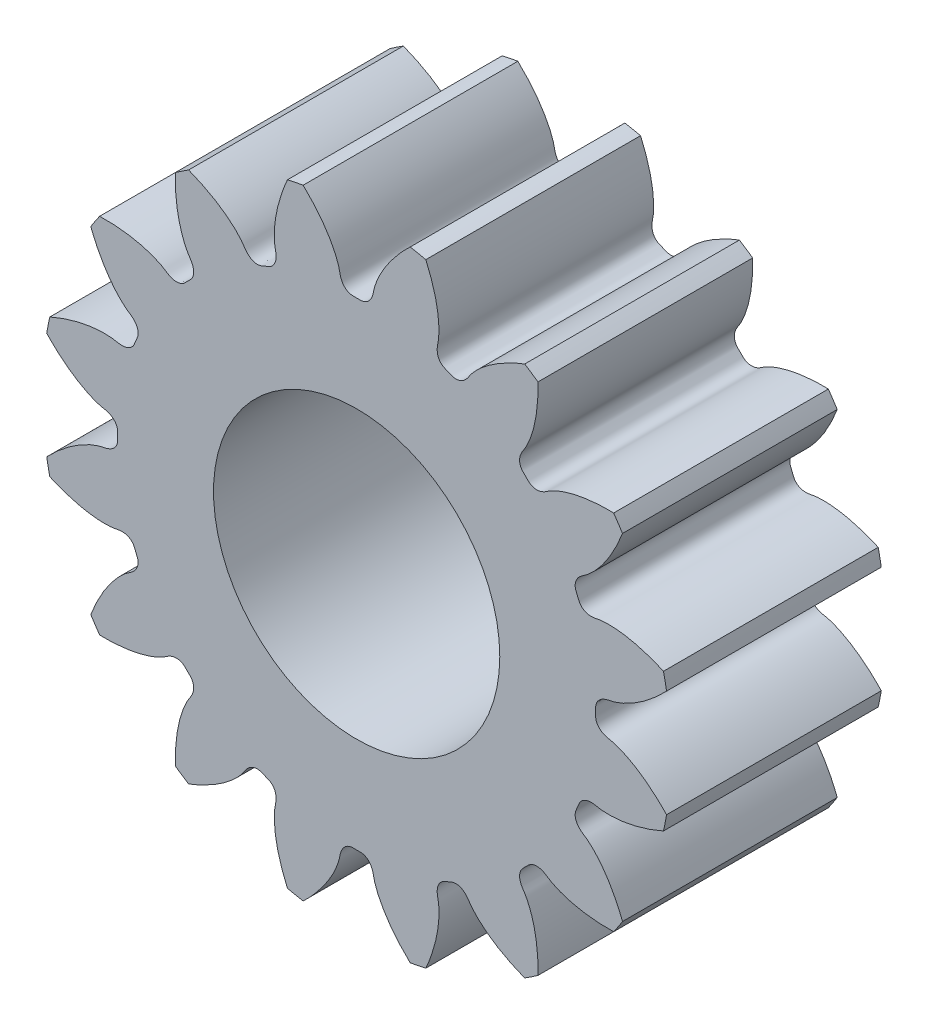
from build123d import *

# Parameters (mm, degrees)
SKETCHREVOLVESPURASSEMBLYNEW1PINION_W       = 6
SKETCHREVOLVESPURASSEMBLYNEW1PINION_H       = 8.7890625
TOOTHEXTRUDECUTSPURASSEMBLYNEW1PINION_DEPTH = 4
PATTERNSPURASSEMBLYNEW1PINION_COUNT         = 16
SKETCH_1_R                                  = 4
CUT_EXTRUDE_1_DEPTH                         = 14.639042679


with BuildPart() as part:
    # SketchRevolveSpurAssemblyNew1Pinion → SpurAssemblyNew1Pinion (revolve)
    with BuildSketch(Plane(origin=(0, 0, 0), x_dir=(0, 0, -1), z_dir=(1, 0, 0))):
        with Locations((-1, 4.39453125)):
            Rectangle(SKETCHREVOLVESPURASSEMBLYNEW1PINION_W, SKETCHREVOLVESPURASSEMBLYNEW1PINION_H)
    revolve(axis=Axis((0, 0, 0), (0, 0, -1)))

    # SketchToothSpurAssemblyNew1Pinion → ToothExtrudeCutSpurAssemblyNew1Pinion (cut, symmetric)
    with BuildSketch(Plane.XY):
        with BuildLine():
            ThreePointArc((8.716029229, 1.554211503), (8.853515625, 0), (8.716029229, -1.554211503))
            add(Edge.make_bspline(
                [(8.716029229, -1.554211503), (8.62862713, -1.459312517), (8.49597106, -1.325274969), (8.314106298, -1.161849014), (8.18489776, -1.054323465), (8.059772215, -0.957996086), (7.9393825, -0.872392365), (7.82435095, -0.797004542), (7.71526784, -0.731293527), (7.612689882, -0.674690752), (7.517138975, -0.626599252), (7.429100479, -0.586397842), (7.349023414, -0.553435542), (7.277314902, -0.527057087), (7.214352885, -0.506532288), (7.160443959, -0.491276196), (7.097952634, -0.475750728), (7.046337113, -0.467920657), (7.004280637, -0.45783036), (6.985712313, -0.452872019), (6.967326671, -0.447394665), (6.949080273, -0.441357303), (6.930926481, -0.434695757), (6.912813897, -0.427331849), (6.894687768, -0.419165828), (6.876491766, -0.410072132), (6.858171606, -0.399892969), (6.839681201, -0.388431378), (6.82099277, -0.375443904), (6.802112664, -0.360634431), (6.783104949, -0.343651932), (6.764124314, -0.32409723), (6.745458017, -0.301546699), (6.727570244, -0.275603076), (6.711137767, -0.245982977), (6.69703376, -0.212637772), (6.686295044, -0.175893357), (6.680036417, -0.13805875), (6.677926166, -0.079083938), (6.68098156, 0), (6.677926166, 0.079083938), (6.680036417, 0.13805875), (6.686295044, 0.175893357), (6.69703376, 0.212637772), (6.711137767, 0.245982977), (6.727570244, 0.275603076), (6.745458017, 0.301546699), (6.764124314, 0.32409723), (6.783104949, 0.343651932), (6.802112664, 0.360634431), (6.82099277, 0.375443904), (6.839681201, 0.388431378), (6.858171606, 0.399892969), (6.876491766, 0.410072132), (6.894687768, 0.419165828), (6.912813897, 0.427331849), (6.930926481, 0.434695757), (6.949080273, 0.441357303), (6.967326671, 0.447394665), (6.985712313, 0.452872019), (7.004280637, 0.45783036), (7.046337113, 0.467920657), (7.097952634, 0.475750728), (7.160443959, 0.491276196), (7.214352885, 0.506532288), (7.277314902, 0.527057087), (7.349023414, 0.553435542), (7.429100479, 0.586397842), (7.517138975, 0.626599252), (7.612689882, 0.674690752), (7.71526784, 0.731293527), (7.82435095, 0.797004542), (7.9393825, 0.872392365), (8.059772215, 0.957996086), (8.18489776, 1.054323465), (8.314106298, 1.161849014), (8.49597106, 1.325274969), (8.62862713, 1.459312517), (8.716029229, 1.554211503)],
                knots=[0, 0, 0, 0, 0.071940146, 0.105070476, 0.136307645, 0.165651652, 0.193102497, 0.218660181, 0.242324703, 0.264096063, 0.283974262, 0.301959299, 0.318051175, 0.332249889, 0.344555442, 0.354967833, 0.363487062, 0.380444448, 0.384031118, 0.387599323, 0.39116026, 0.394726966, 0.398314667, 0.401941182, 0.405627388, 0.409397748, 0.413280862, 0.417309997, 0.421523496, 0.425964841, 0.430682071, 0.43572602, 0.44114668, 0.446986911, 0.453273001, 0.460002642, 0.467132884, 0.474573007, 0.481318675, 0.5, 0.518681325, 0.525426993, 0.532867116, 0.539997358, 0.546726999, 0.553013089, 0.55885332, 0.56427398, 0.569317929, 0.574035159, 0.578476504, 0.582690003, 0.586719138, 0.590602252, 0.594372612, 0.598058818, 0.601685333, 0.605273034, 0.60883974, 0.612400677, 0.615968882, 0.619555552, 0.636512938, 0.645032167, 0.655444558, 0.667750111, 0.681948825, 0.698040701, 0.716025738, 0.735903937, 0.757675297, 0.781339819, 0.806897503, 0.834348348, 0.863692355, 0.894929524, 0.928059854, 1, 1, 1, 1], degree=3))
        make_face()
    toothextrudecutspurassemblynew1pinion = extrude(amount=TOOTHEXTRUDECUTSPURASSEMBLYNEW1PINION_DEPTH, both=True, mode=Mode.SUBTRACT)

    # PatternSpurAssemblyNew1Pinion: ToothExtrudeCutSpurAssemblyNew1Pinion ×16 about axis
    patternspurassemblynew1pinion_axis = Axis((0, 0, 50), (0, 0, -1))
    for i in range(1, PATTERNSPURASSEMBLYNEW1PINION_COUNT):
        add(toothextrudecutspurassemblynew1pinion.rotate(patternspurassemblynew1pinion_axis, i * 360 / PATTERNSPURASSEMBLYNEW1PINION_COUNT), mode=Mode.SUBTRACT)

    # Эскиз1 → Вырез-Вытянуть1 (cut, through all)
    with BuildSketch(Plane.XY.offset(4)):
        Circle(SKETCH_1_R)
    extrude(amount=-CUT_EXTRUDE_1_DEPTH, mode=Mode.SUBTRACT)


solid = part.part
